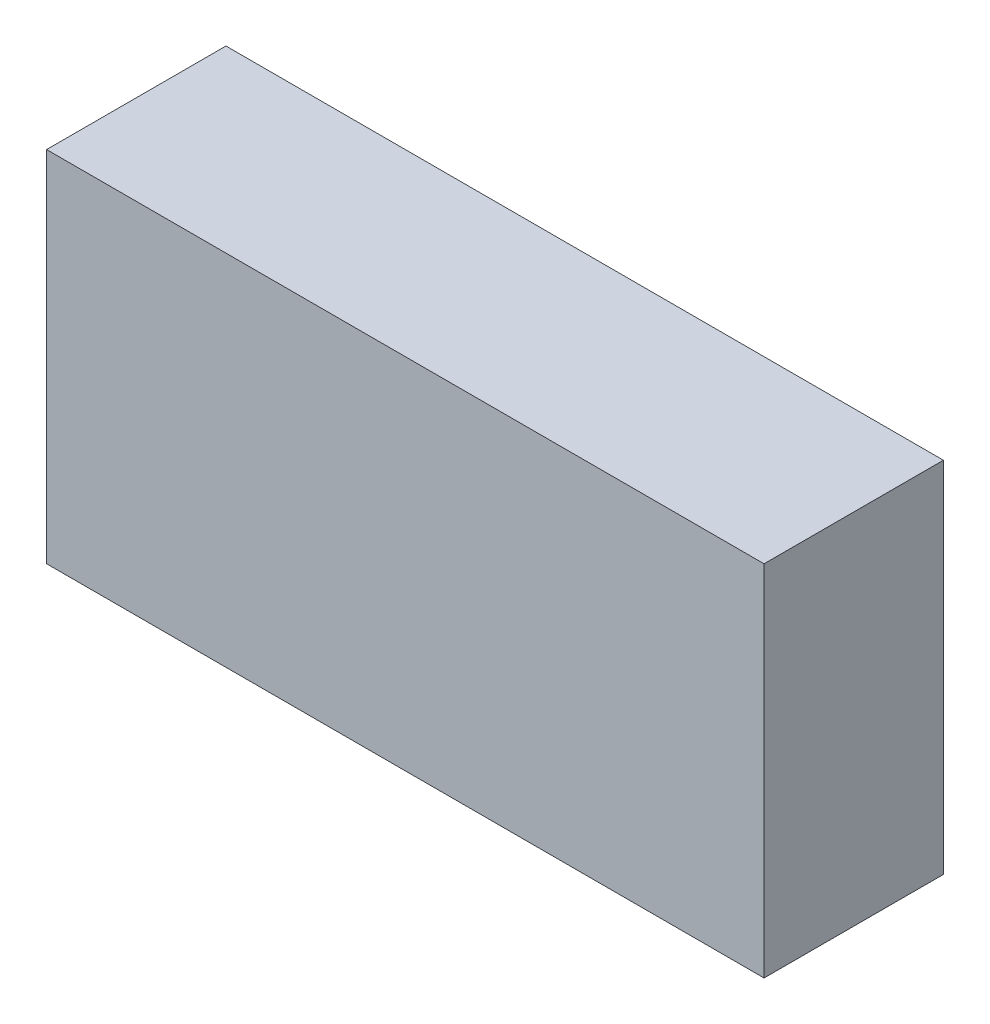
from build123d import *

# Parameters (mm, degrees)
SKETCH1_W           = 101.6
SKETCH1_H           = 50.8
BOSS_EXTRUDE1_DEPTH = 25.4


with BuildPart() as part:
    # Sketch1 → Boss-Extrude1 (new body)
    with BuildSketch(Plane.XY):
        with Locations((-15.762277483, 18.991931469)):
            Rectangle(SKETCH1_W, SKETCH1_H)
    extrude(amount=BOSS_EXTRUDE1_DEPTH)


solid = part.part
